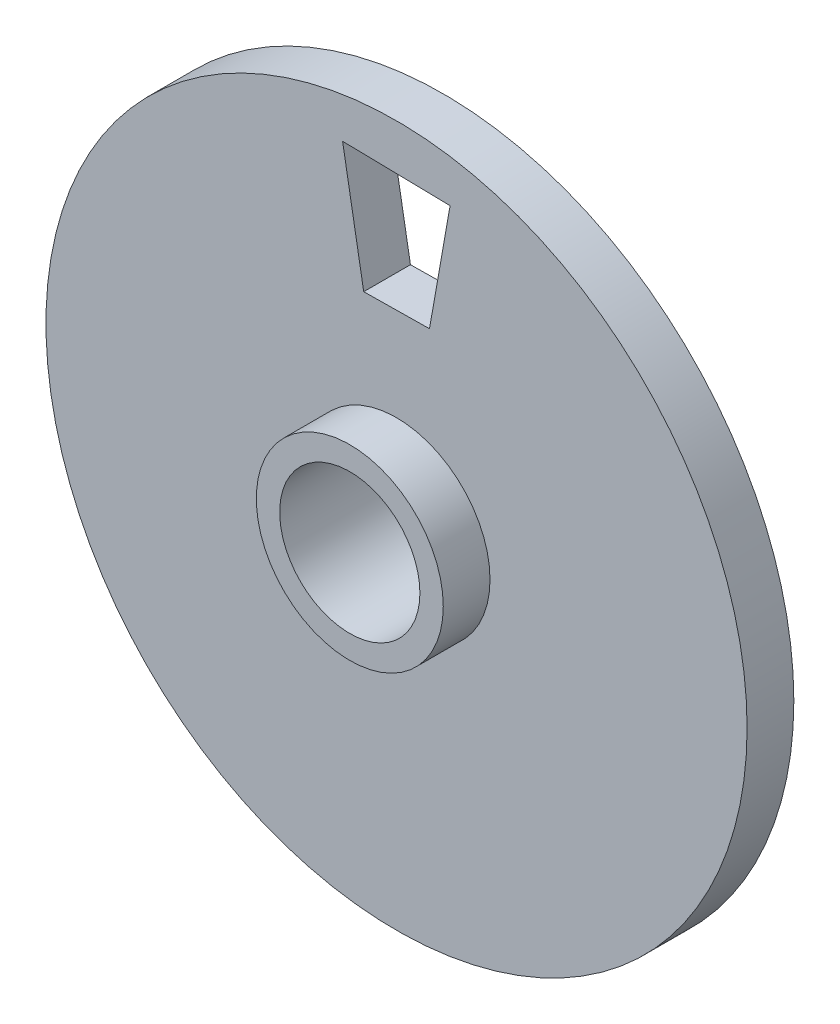
from build123d import *

# Parameters (mm, degrees)
SKETCH_1_R      = 4
SKETCH_1_R_2    = 3
EXTRUDE_1_DEPTH = 2
SKETCH_2_R      = 15
SKETCH_2_R_2    = 3
EXTRUDE_2_DEPTH = 2
SKETCH_3_R      = 4
SKETCH_3_R_2    = 3
EXTRUDE_3_DEPTH = 2


with BuildPart() as part:
    # Эскиз1 → Бобышка-Вытянуть1 (new body)
    with BuildSketch(Plane.XY):
        Circle(SKETCH_1_R)
        Circle(SKETCH_1_R_2, mode=Mode.SUBTRACT)
    extrude(amount=EXTRUDE_1_DEPTH)

    # Эскиз2 → Бобышка-Вытянуть2 (add)
    with BuildSketch(Plane.XY.offset(2)):
        Circle(SKETCH_2_R)
        Circle(SKETCH_2_R_2, mode=Mode.SUBTRACT)
        Polygon((-1.404174417, 7.963468844), (-2.307449736, 13.086197736), (2.292250749, 13), (1.410615846, 8), align=None, mode=Mode.SUBTRACT)
    extrude(amount=EXTRUDE_2_DEPTH)

    # Эскиз3 → Бобышка-Вытянуть3 (add)
    with BuildSketch(Plane.XY.offset(4)):
        Circle(SKETCH_3_R)
        Circle(SKETCH_3_R_2, mode=Mode.SUBTRACT)
    extrude(amount=EXTRUDE_3_DEPTH)


solid = part.part
